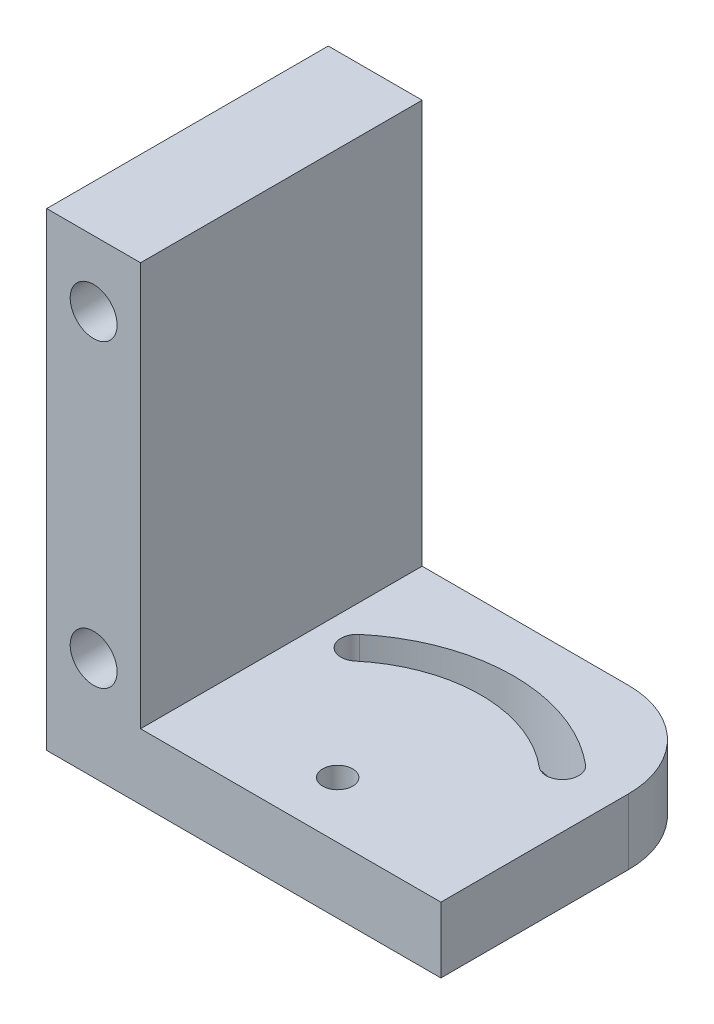
from build123d import *

# Parameters (mm, degrees)
SKETCH1_R           = 1.6
BOSS_EXTRUDE1_DEPTH = 7
SKETCH1_3_W         = 10
SKETCH1_3_H         = 30
BOSS_EXTRUDE2_DEPTH = 50
SKETCH2_R           = 2.5
CUT_EXTRUDE1_DEPTH  = 63.790013573


with BuildPart() as part:
    # Sketch1 → Boss-Extrude1 (new body)
    with BuildSketch(Plane(origin=(0, 0, 0), x_dir=(1, 0, 0), z_dir=(0, 1, 0))):
        with BuildLine():
            Line((-23.293471286, 8.868329827), (-23.293471286, -21.131670173))
            Line((-23.293471286, -21.131670173), (18.706528714, -21.131670173))
            Line((18.706528714, -21.131670173), (18.706528714, -1.131670173))
            ThreePointArc((18.706528714, -1.131670173), (15.777596526, 5.939397639), (8.706528714, 8.868329827))
            Line((8.706528714, 8.868329827), (-23.293471286, 8.868329827))
        make_face()
        with BuildLine():
            ThreePointArc((13.758796396, -0.768336864), (13.974495854, -3.233792957), (11.509039762, -3.449492415))
            ThreePointArc((11.509039762, -3.449492415), (1.706528714, 0.118329827), (-8.095982334, -3.449492415))
            ThreePointArc((-8.095982334, -3.449492415), (-10.561438426, -3.233792957), (-10.345738968, -0.768336864))
            ThreePointArc((-10.345738968, -0.768336864), (1.706528714, 3.618329827), (13.758796396, -0.768336864))
        make_face(mode=Mode.SUBTRACT)
        with Locations((1.706528714, -15.131670173)):
            Circle(SKETCH1_R, mode=Mode.SUBTRACT)
    extrude(amount=BOSS_EXTRUDE1_DEPTH)

    # Sketch1<3> → Boss-Extrude2 (add)
    with BuildSketch(Plane(origin=(0, 0, 0), x_dir=(1, 0, 0), z_dir=(0, 1, 0))):
        with Locations((-18.293471286, -6.131670173)):
            Rectangle(SKETCH1_3_W, SKETCH1_3_H)
    extrude(amount=BOSS_EXTRUDE2_DEPTH)

    # Sketch2 → Cut-Extrude1 (cut, through all)
    with BuildSketch(Plane(origin=(0, 0, -8.868329827), x_dir=(-1, 0, 0), z_dir=(0, 0, -1))):
        with Locations((18.293471286, 43)):
            Circle(SKETCH2_R)
        with Locations((18.293471286, 11)):
            Circle(SKETCH2_R)
    extrude(amount=-CUT_EXTRUDE1_DEPTH, mode=Mode.SUBTRACT)


solid = part.part
